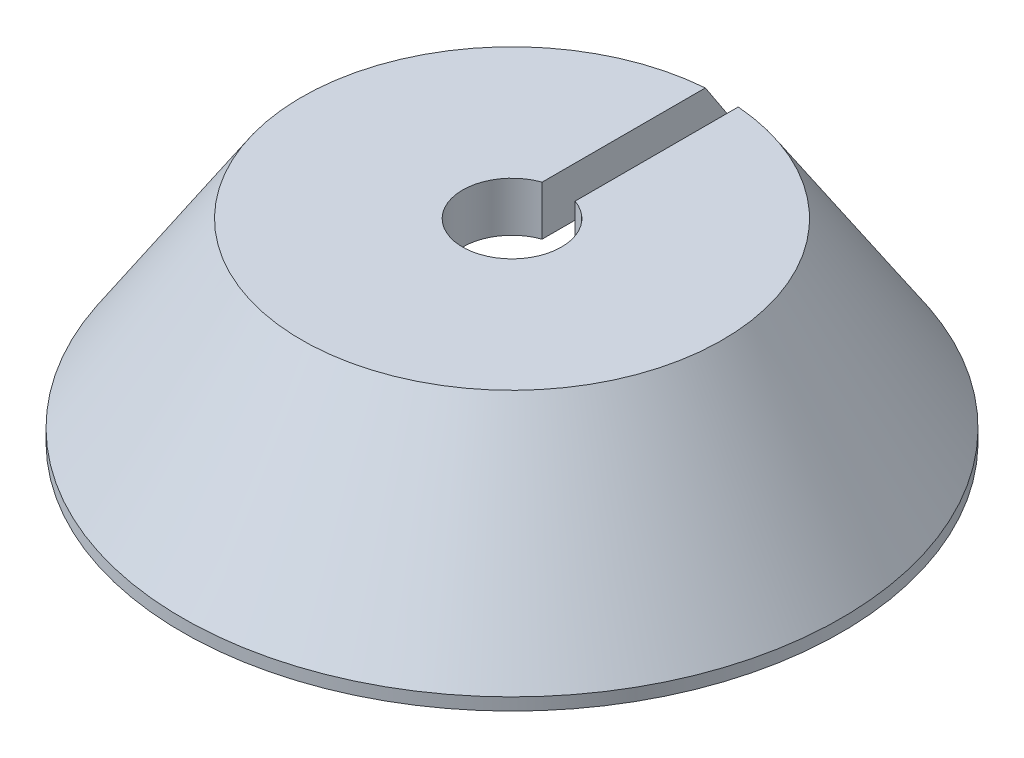
from build123d import *

# Parameters (mm, degrees)
SKETCH_4_W          = 0.8
SKETCH_4_H          = 5.94447729
CUT_EXTRUDE_1_DEPTH = 10


with BuildPart() as part:
    # 草图2 → 旋转1 (revolve)
    with BuildSketch(Plane.XY, mode=Mode.PRIVATE) as revolve_1_sk:
        Polygon((0, 0), (8, 0), (8, 0.299164486), (5.108022377, 4.7), (0, 4.7), align=None)
    revolve(revolve_1_sk.sketch.rotate(Axis((0, 6.286953345, 0), (0, -1, 0)), 90), axis=Axis((0, 6.286953345, 0), (0, -1, 0)))

    # 草图3 → 切除-旋转1 (revolve, cut)
    with BuildSketch(Plane.XY, mode=Mode.PRIVATE) as cut_revolve_1_sk:
        Polygon((1.2, 3.5), (1.2, 6.5), (0, 6.5), (0, 0), (7, 0), (4.7, 3.5), align=None)
    revolve(cut_revolve_1_sk.sketch.rotate(Axis((0, 5.949565502, 0), (0, -1, 0)), 90), axis=Axis((0, 5.949565502, 0), (0, -1, 0)), mode=Mode.SUBTRACT)

    # 草图4 → 切除-拉伸1 (cut)
    with BuildSketch(Plane.XY):
        with Locations((0, 2.524530629)):
            Rectangle(SKETCH_4_W, SKETCH_4_H)
    extrude(amount=-CUT_EXTRUDE_1_DEPTH, mode=Mode.SUBTRACT)


solid = part.part
